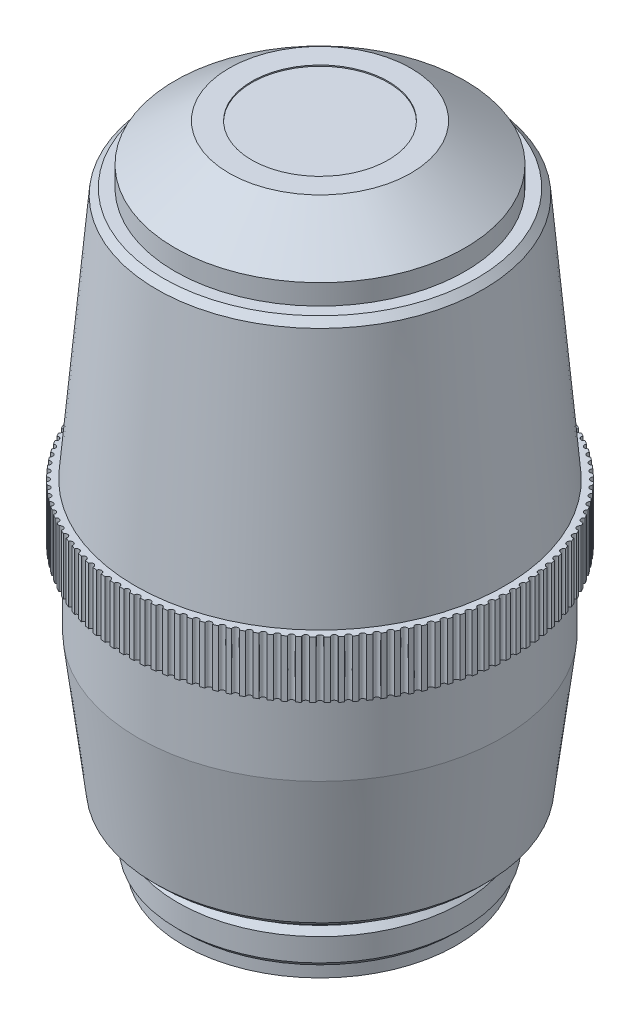
from build123d import *

# Parameters (mm, degrees)
SKETCH2_R          = 4.5
CUT_EXTRUDE1_DEPTH = 3
CUT_EXTRUDE2_DEPTH = 39.055879966
CIRPATTERN1_COUNT  = 120
SKETCH4_R          = 6
CUT_EXTRUDE3_DEPTH = 0.1


with BuildPart() as part:
    # Sketch1 → Revolve1 (revolve)
    with BuildSketch(Plane(origin=(0, 0, 0), x_dir=(0, 0, -1), z_dir=(1, 0, 0))):
        Polygon((0, 28.405), (0, -28.405), (-12, -28.405), (-12, -27.405), (-12.5, -26.905), (-12.5, -24.905), (-12, -24.405), (-12, -23.405), (-13.301142181, -23.405), (-13.551142181, -23.155), (-13.551142181, -22.905), (-14.051142181, -22.905), (-14.551142181, -22.405), (-16, -10.605), (-16, -3.905), (-17, -3.905), (-17, 1.095), (-16.25, 1.095), (-14.357242732, 22.729314575), (-13.791557307, 23.295), (-12.75, 23.295), (-12.75, 25.079014194), (-8, 28.405), align=None)
    revolve(axis=Axis((0, 40, 0), (0, -1, 0)))

    # Sketch2 → Cut-Extrude1 (cut)
    with BuildSketch(Plane(origin=(0, -28.405, 0), x_dir=(-1, 0, 0), z_dir=(0, -1, 0))):
        Circle(SKETCH2_R)
    extrude(amount=-CUT_EXTRUDE1_DEPTH, mode=Mode.SUBTRACT)

    # Sketch3 → Cut-Extrude2 (cut, symmetric)
    with BuildSketch(Plane(origin=(0, 1.095, 0), x_dir=(1, 0, 0), z_dir=(0, 1, 0))):
        with BuildLine():
            Line((0.884169306, 103.243774968), (0.249993242, 16.998161765))
            ThreePointArc((0.249993242, 16.998161765), (0, 16.75), (-0.249993242, 16.998161765))
            Line((-0.249993242, 16.998161765), (-0.884169306, 103.243774968))
            Line((-0.884169306, 103.243774968), (-0.884169306, 275.739664498))
            Line((-0.884169306, 275.739664498), (0.884169306, 275.739664498))
            Line((0.884169306, 275.739664498), (0.884169306, 103.243774968))
        make_face()
    cut_extrude2 = extrude(amount=CUT_EXTRUDE2_DEPTH, both=True, mode=Mode.SUBTRACT)

    # CirPattern1: Cut-Extrude2 ×120 about axis
    cirpattern1_axis = Axis((0, 40, 0), (0, 1, 0))
    for i in range(1, CIRPATTERN1_COUNT):
        add(cut_extrude2.rotate(cirpattern1_axis, i * 360 / CIRPATTERN1_COUNT), mode=Mode.SUBTRACT)

    # Sketch4 → Cut-Extrude3 (cut)
    with BuildSketch(Plane(origin=(0, 28.405, 0), x_dir=(1, 0, 0), z_dir=(0, 1, 0))):
        Circle(SKETCH4_R)
    extrude(amount=-CUT_EXTRUDE3_DEPTH, mode=Mode.SUBTRACT)


solid = part.part
